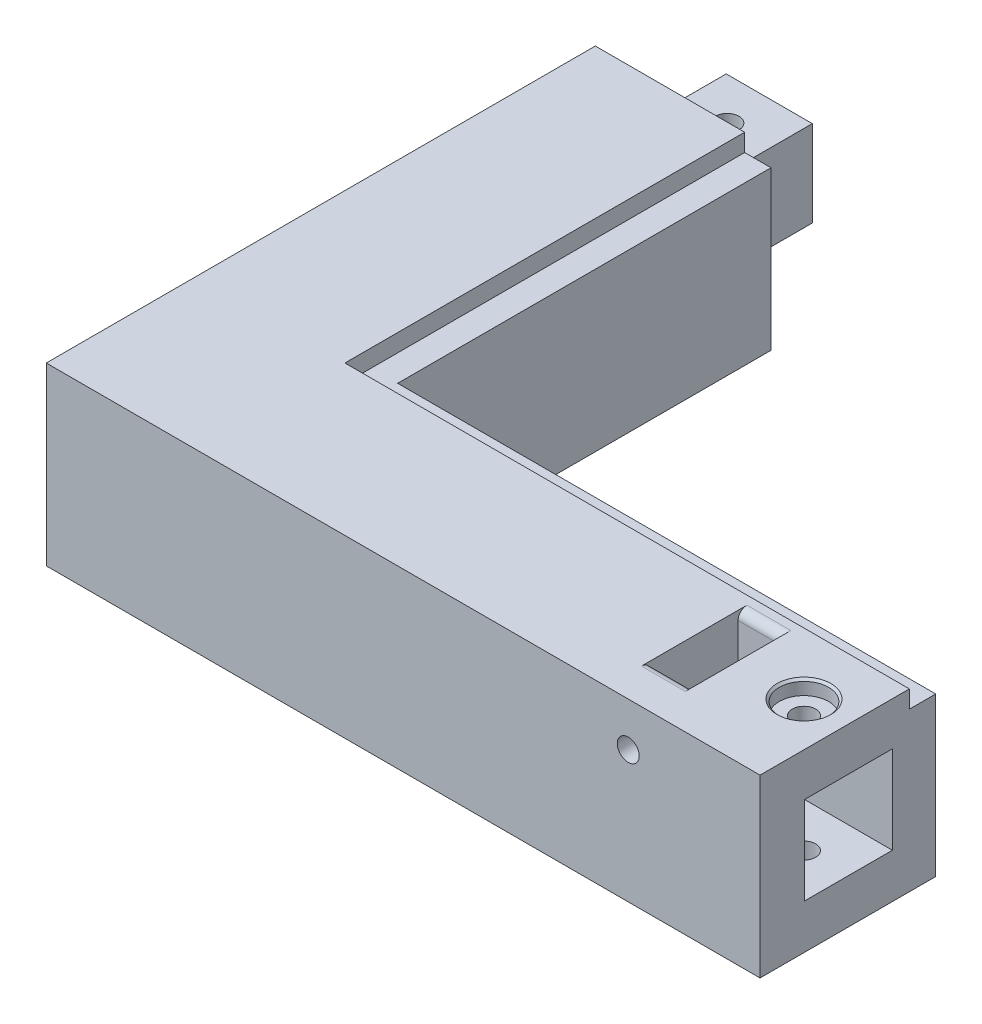
from build123d import *

# Parameters (mm, degrees)
BOSS_EXTRUDE1_DEPTH = 50.8
SKETCH3_W           = 25.4
SKETCH3_H           = 25.4
CUT_EXTRUDE1_DEPTH  = 25.4
SKETCH8_W           = 24.892
SKETCH8_H           = 24.892
BOSS_EXTRUDE2_DEPTH = 24.892
SKETCH12_R          = 3.429
CUT_EXTRUDE2_DEPTH  = 25.4
SKETCH13_W          = 12.7
SKETCH13_H          = 25.4
CUT_EXTRUDE3_DEPTH  = 25.908
FILLET1_R           = 2.54
CUT_EXTRUDE6_DEPTH  = 5.08
SKETCH15_R          = 3.175
CUT_EXTRUDE7_DEPTH  = 246.984968624


with BuildPart() as part:
    # Sketch2 → Boss-Extrude1 (new body)
    with BuildSketch(Plane(origin=(0, 0, 0), x_dir=(1, 0, 0), z_dir=(0, 1, 0))):
        Polygon((-50.8, 107.95), (0, 107.95), (0, 0), (155.575, 0), (155.575, -50.8), (-50.8, -50.8), align=None)
    extrude(amount=BOSS_EXTRUDE1_DEPTH)

    # Sketch3 → Cut-Extrude1 (cut)
    with BuildSketch(Plane(origin=(155.575, 0, 0), x_dir=(0, 0, -1), z_dir=(1, 0, 0))):
        with Locations((-25.239912, 25.560088)):
            Rectangle(SKETCH3_W, SKETCH3_H)
    extrude(amount=-CUT_EXTRUDE1_DEPTH, mode=Mode.SUBTRACT)

    # Sketch7 → CBORE for 1/4 Binding Head Machine Screw1 (revolve, cut)
    with BuildSketch(Plane(origin=(142.875, 50.8, 25.4), x_dir=(0, 0, 1), z_dir=(1, 0, 0))):
        Polygon((0, 0), (0, 50.8), (3.3782, 50.8), (3.3782, 4.191), (7.14375, 4.191), (7.14375, 0.635), (7.77875, 0), align=None)
    revolve(axis=Axis((142.875, 57.15, 25.4), (0, -1, 0)), mode=Mode.SUBTRACT)

    # Sketch8 → Boss-Extrude2 (add)
    with BuildSketch(Plane(origin=(0, 0, -107.95), x_dir=(-1, 0, 0), z_dir=(0, 0, -1))):
        with Locations((25.4, 25.4)):
            Rectangle(SKETCH8_W, SKETCH8_H)
    extrude(amount=BOSS_EXTRUDE2_DEPTH)

    # Sketch12 → Cut-Extrude2 (cut)
    with BuildSketch(Plane(origin=(0, 37.846, 0), x_dir=(1, 0, 0), z_dir=(0, 1, 0))):
        with Locations(Location((-25.4, 120.65, 0), (0, 0, 270))):
            Circle(SKETCH12_R)
    extrude(amount=-CUT_EXTRUDE2_DEPTH, mode=Mode.SUBTRACT)

    # Sketch13 → Cut-Extrude3 (cut)
    with BuildSketch(Plane(origin=(0, 50.8, 0), x_dir=(1, 0, 0), z_dir=(0, 1, 0))):
        with Locations((117.475, -25.4)):
            Rectangle(SKETCH13_W, SKETCH13_H)
    extrude(amount=-CUT_EXTRUDE3_DEPTH, mode=Mode.SUBTRACT)

    # Fillet1
    fillet1_edges = [part.edges().sort_by_distance(p)[0] for p in [
        (117.475, 50.8, 12.7),
        (117.475, 50.8, 38.1),
    ]]
    fillet(fillet1_edges, radius=FILLET1_R)

    # Sketch17 → Cut-Extrude6 (cut)
    with BuildSketch(Plane(origin=(0, 50.8, 0), x_dir=(1, 0, 0), z_dir=(0, 1, 0))):
        Polygon((0, 107.95), (0, 0), (155.575, 0), (155.575, -7.62), (-7.62, -7.62), (-7.62, 107.95), align=None)
    extrude(amount=-CUT_EXTRUDE6_DEPTH, mode=Mode.SUBTRACT)

    # Sketch15 → Cut-Extrude7 (cut, through all)
    with BuildSketch(Plane.XY.offset(50.8)):
        with Locations((117.475, 38.1)):
            Circle(SKETCH15_R)
    extrude(amount=-CUT_EXTRUDE7_DEPTH, mode=Mode.SUBTRACT)


solid = part.part
